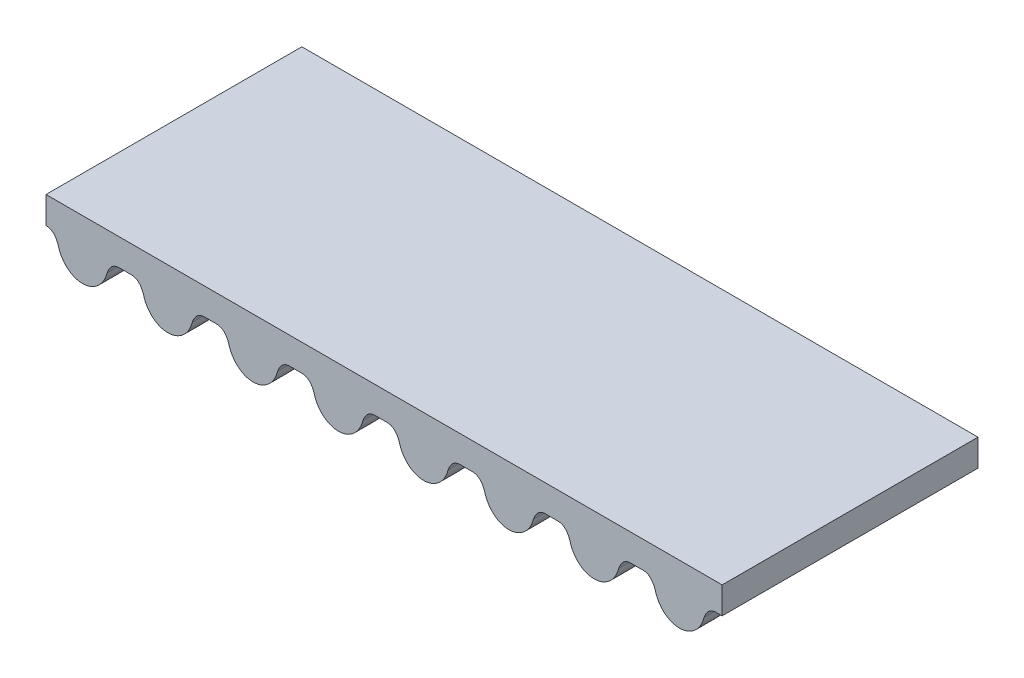
from build123d import *

# Parameters (mm, degrees)
BOSS_EXTRUDE1_DEPTH      = 3
BOSS_EXTRUDE1_DEPTH_BACK = 3


with BuildPart() as part:
    # Sketch1 → Boss-Extrude1 (new, two sides: drawn at the far end of the back side and taken through both)
    with BuildSketch(Plane.XY.offset(-BOSS_EXTRUDE1_DEPTH_BACK)):
        with BuildLine():
            Line((0, 0.75), (0, 1.3798))
            Line((0, 1.3798), (3.8572, 1.3798))
            Line((3.8572, 1.3798), (7.8572, 1.3798))
            Line((7.8572, 1.3798), (11.8572, 1.3798))
            Line((11.8572, 1.3798), (15.8572, 1.3798))
            Line((15.8572, 1.3798), (15.8572, 0.75))
            Line((15.8572, 0.75), (15.7144, 0.75))
            add(Edge.make_bspline(
                [(15.43, 0.4991), (15.5198, 0.75), (15.7144, 0.75)],
                knots=[0.872727273, 0.872727273, 0.872727273, 0.890909091, 0.890909091, 0.890909091], degree=2))
            add(Edge.make_bspline(
                [(14.8572, 0), (15.13, 0), (15.3594, 0.2112), (15.43, 0.4991)],
                knots=[0.854545455, 0.854545455, 0.854545455, 0.854545455, 0.872727273, 0.872727273, 0.872727273, 0.872727273], degree=3))
            add(Edge.make_bspline(
                [(14.2844, 0.4991), (14.355, 0.2112), (14.5844, 0), (14.8572, 0)],
                knots=[0.836363636, 0.836363636, 0.836363636, 0.836363636, 0.854545455, 0.854545455, 0.854545455, 0.854545455], degree=3))
            add(Edge.make_bspline(
                [(14, 0.75), (14.1946, 0.75), (14.2844, 0.4991)],
                knots=[0.818181818, 0.818181818, 0.818181818, 0.836363636, 0.836363636, 0.836363636], degree=2))
            Line((14, 0.75), (13.8572, 0.75))
            Line((13.8572, 0.75), (13.7144, 0.75))
            add(Edge.make_bspline(
                [(13.43, 0.4991), (13.5198, 0.75), (13.7144, 0.75)],
                knots=[0.763636364, 0.763636364, 0.763636364, 0.781818182, 0.781818182, 0.781818182], degree=2))
            add(Edge.make_bspline(
                [(12.8572, 0), (13.13, 0), (13.3594, 0.2112), (13.43, 0.4991)],
                knots=[0.745454545, 0.745454545, 0.745454545, 0.745454545, 0.763636364, 0.763636364, 0.763636364, 0.763636364], degree=3))
            add(Edge.make_bspline(
                [(12.2844, 0.4991), (12.355, 0.2112), (12.5844, 0), (12.8572, 0)],
                knots=[0.727272727, 0.727272727, 0.727272727, 0.727272727, 0.745454545, 0.745454545, 0.745454545, 0.745454545], degree=3))
            add(Edge.make_bspline(
                [(12, 0.75), (12.1946, 0.75), (12.2844, 0.4991)],
                knots=[0.709090909, 0.709090909, 0.709090909, 0.727272727, 0.727272727, 0.727272727], degree=2))
            Line((12, 0.75), (11.8572, 0.75))
            Line((11.8572, 0.75), (11.7144, 0.75))
            add(Edge.make_bspline(
                [(11.43, 0.4991), (11.5198, 0.75), (11.7144, 0.75)],
                knots=[0.654545455, 0.654545455, 0.654545455, 0.672727273, 0.672727273, 0.672727273], degree=2))
            add(Edge.make_bspline(
                [(10.8572, 0), (11.13, 0), (11.3594, 0.2112), (11.43, 0.4991)],
                knots=[0.636363636, 0.636363636, 0.636363636, 0.636363636, 0.654545455, 0.654545455, 0.654545455, 0.654545455], degree=3))
            add(Edge.make_bspline(
                [(10.2844, 0.4991), (10.355, 0.2112), (10.5844, 0), (10.8572, 0)],
                knots=[0.618181818, 0.618181818, 0.618181818, 0.618181818, 0.636363636, 0.636363636, 0.636363636, 0.636363636], degree=3))
            add(Edge.make_bspline(
                [(10, 0.75), (10.1946, 0.75), (10.2844, 0.4991)],
                knots=[0.6, 0.6, 0.6, 0.618181818, 0.618181818, 0.618181818], degree=2))
            Line((10, 0.75), (9.8572, 0.75))
            Line((9.8572, 0.75), (9.7144, 0.75))
            add(Edge.make_bspline(
                [(9.43, 0.4991), (9.5198, 0.75), (9.7144, 0.75)],
                knots=[0.545454545, 0.545454545, 0.545454545, 0.563636364, 0.563636364, 0.563636364], degree=2))
            add(Edge.make_bspline(
                [(8.8572, 0), (9.13, 0), (9.3594, 0.2112), (9.43, 0.4991)],
                knots=[0.527272727, 0.527272727, 0.527272727, 0.527272727, 0.545454545, 0.545454545, 0.545454545, 0.545454545], degree=3))
            add(Edge.make_bspline(
                [(8.2844, 0.4991), (8.355, 0.2112), (8.5844, 0), (8.8572, 0)],
                knots=[0.509090909, 0.509090909, 0.509090909, 0.509090909, 0.527272727, 0.527272727, 0.527272727, 0.527272727], degree=3))
            add(Edge.make_bspline(
                [(8, 0.75), (8.1946, 0.75), (8.2844, 0.4991)],
                knots=[0.490909091, 0.490909091, 0.490909091, 0.509090909, 0.509090909, 0.509090909], degree=2))
            Line((8, 0.75), (7.8572, 0.75))
            Line((7.8572, 0.75), (7.7144, 0.75))
            add(Edge.make_bspline(
                [(7.43, 0.4991), (7.5198, 0.75), (7.7144, 0.75)],
                knots=[0.436363636, 0.436363636, 0.436363636, 0.454545455, 0.454545455, 0.454545455], degree=2))
            add(Edge.make_bspline(
                [(6.8572, 0), (7.13, 0), (7.3594, 0.2112), (7.43, 0.4991)],
                knots=[0.418181818, 0.418181818, 0.418181818, 0.418181818, 0.436363636, 0.436363636, 0.436363636, 0.436363636], degree=3))
            add(Edge.make_bspline(
                [(6.2844, 0.4991), (6.355, 0.2112), (6.5844, 0), (6.8572, 0)],
                knots=[0.4, 0.4, 0.4, 0.4, 0.418181818, 0.418181818, 0.418181818, 0.418181818], degree=3))
            add(Edge.make_bspline(
                [(6, 0.75), (6.1946, 0.75), (6.2844, 0.4991)],
                knots=[0.381818182, 0.381818182, 0.381818182, 0.4, 0.4, 0.4], degree=2))
            Line((6, 0.75), (5.8572, 0.75))
            Line((5.8572, 0.75), (5.7144, 0.75))
            add(Edge.make_bspline(
                [(5.43, 0.4991), (5.5198, 0.75), (5.7144, 0.75)],
                knots=[0.327272727, 0.327272727, 0.327272727, 0.345454545, 0.345454545, 0.345454545], degree=2))
            add(Edge.make_bspline(
                [(4.8572, 0), (5.13, 0), (5.3594, 0.2112), (5.43, 0.4991)],
                knots=[0.309090909, 0.309090909, 0.309090909, 0.309090909, 0.327272727, 0.327272727, 0.327272727, 0.327272727], degree=3))
            add(Edge.make_bspline(
                [(4.2844, 0.4991), (4.355, 0.2112), (4.5844, 0), (4.8572, 0)],
                knots=[0.290909091, 0.290909091, 0.290909091, 0.290909091, 0.309090909, 0.309090909, 0.309090909, 0.309090909], degree=3))
            add(Edge.make_bspline(
                [(4, 0.75), (4.1946, 0.75), (4.2844, 0.4991)],
                knots=[0.272727273, 0.272727273, 0.272727273, 0.290909091, 0.290909091, 0.290909091], degree=2))
            Line((4, 0.75), (3.8572, 0.75))
            Line((3.8572, 0.75), (3.7144, 0.75))
            add(Edge.make_bspline(
                [(3.43, 0.4991), (3.5198, 0.75), (3.7144, 0.75)],
                knots=[0.218181818, 0.218181818, 0.218181818, 0.236363636, 0.236363636, 0.236363636], degree=2))
            add(Edge.make_bspline(
                [(2.8572, 0), (3.13, 0), (3.3594, 0.2112), (3.43, 0.4991)],
                knots=[0.2, 0.2, 0.2, 0.2, 0.218181818, 0.218181818, 0.218181818, 0.218181818], degree=3))
            add(Edge.make_bspline(
                [(2.2844, 0.4991), (2.355, 0.2112), (2.5844, 0), (2.8572, 0)],
                knots=[0.181818182, 0.181818182, 0.181818182, 0.181818182, 0.2, 0.2, 0.2, 0.2], degree=3))
            add(Edge.make_bspline(
                [(2, 0.75), (2.1946, 0.75), (2.2844, 0.4991)],
                knots=[0.163636364, 0.163636364, 0.163636364, 0.181818182, 0.181818182, 0.181818182], degree=2))
            Line((2, 0.75), (1.8572, 0.75))
            Line((1.8572, 0.75), (1.7144, 0.75))
            add(Edge.make_bspline(
                [(1.43, 0.4991), (1.5198, 0.75), (1.7144, 0.75)],
                knots=[0.109090909, 0.109090909, 0.109090909, 0.127272727, 0.127272727, 0.127272727], degree=2))
            add(Edge.make_bspline(
                [(0.8572, 0), (1.13, 0), (1.3594, 0.2112), (1.43, 0.4991)],
                knots=[0.090909091, 0.090909091, 0.090909091, 0.090909091, 0.109090909, 0.109090909, 0.109090909, 0.109090909], degree=3))
            add(Edge.make_bspline(
                [(0.2844, 0.4991), (0.355, 0.2112), (0.5844, 0), (0.8572, 0)],
                knots=[0.072727273, 0.072727273, 0.072727273, 0.072727273, 0.090909091, 0.090909091, 0.090909091, 0.090909091], degree=3))
            add(Edge.make_bspline(
                [(0, 0.75), (0.1946, 0.75), (0.2844, 0.4991)],
                knots=[0.054545455, 0.054545455, 0.054545455, 0.072727273, 0.072727273, 0.072727273], degree=2))
        make_face()
    extrude(amount=BOSS_EXTRUDE1_DEPTH + BOSS_EXTRUDE1_DEPTH_BACK)


solid = part.part
